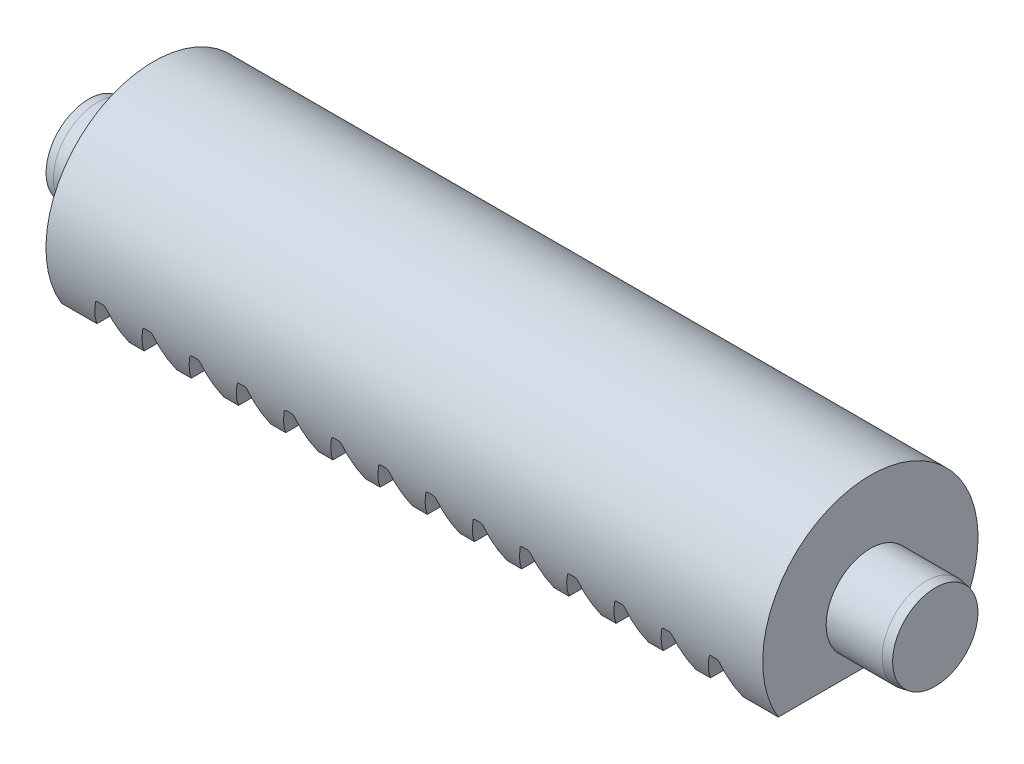
from build123d import *

# Parameters (mm, degrees)
CUT_EXTRUDE_1_DEPTH      = 153.501639335
CUT_EXTRUDE_1_DEPTH_BACK = 153.501639335
SKETCH_2_W               = 243
SKETCH_2_H               = 17.6
CUT_EXTRUDE_2_DEPTH      = 153.501639335
PATTERN_LINEAR_1_COUNT   = 14
PATTERN_LINEAR_1_PITCH   = 16


with BuildPart() as part:
    # Эскиз1 → Повернуть1 (revolve)
    with BuildSketch(Plane.XY, mode=Mode.PRIVATE) as revolve_1_sk:
        Polygon((-143.5, 0), (-143.5, 14.471019058), (-140.5, 15), (-121.5, 15), (-121.5, 36.5), (121.5, 36.5), (121.5, 15), (140.5, 15), (143.5, 14.471019058), (143.5, 0), align=None)
    revolve(revolve_1_sk.sketch.rotate(Axis((-162.765436154, 0, 0), (1, 0, 0)), 90), axis=Axis((-162.765436154, 0, 0), (1, 0, 0)))

    # Эскиз2 → Вырез-Вытянуть1 (cut, two sides: drawn at the far end of the back side and taken through both)
    with BuildSketch(Plane.XY.offset(-CUT_EXTRUDE_1_DEPTH_BACK)):
        with Locations((0, -27.7)):
            Rectangle(SKETCH_2_W, SKETCH_2_H)
    extrude(amount=CUT_EXTRUDE_1_DEPTH + CUT_EXTRUDE_1_DEPTH_BACK, mode=Mode.SUBTRACT)

    # Эскиз3 → Вырез-Вытянуть2 (cut, symmetric)
    with BuildSketch(Plane.XY):
        with BuildLine():
            Line((109.5, -18.9), (105.735812506, -8.557979857))
            ThreePointArc((105.735812506, -8.557979857), (105.369696321, -8.080847956), (104.796119885, -7.9))
            Line((104.796119885, -7.9), (103.203880115, -7.9))
            ThreePointArc((103.203880115, -7.9), (102.630303679, -8.080847956), (102.264187494, -8.557979857))
            Line((102.264187494, -8.557979857), (98.5, -18.9))
            Line((98.5, -18.9), (109.5, -18.9))
        make_face()
    cut_extrude_2 = extrude(amount=CUT_EXTRUDE_2_DEPTH, both=True, mode=Mode.SUBTRACT)

    # Линейный массив1: Вырез-Вытянуть2 ×14
    with Locations(*[(-i * PATTERN_LINEAR_1_PITCH, 0, 0) for i in range(1, PATTERN_LINEAR_1_COUNT)]):
        add(cut_extrude_2, mode=Mode.SUBTRACT)


solid = part.part
